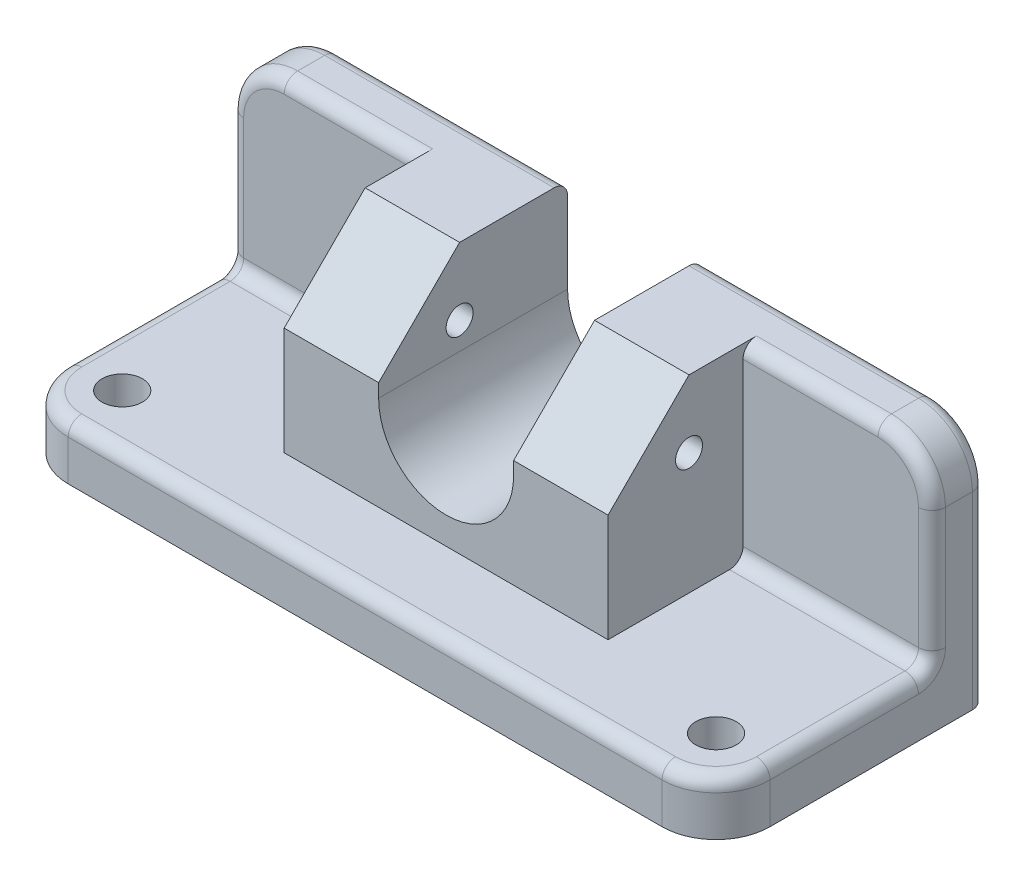
from build123d import *

# Parameters (mm, degrees)
SKETCH1_W                  = 130
SKETCH1_H                  = 100
BOSS_EXTRUDE1_DEPTH        = 20
SKETCH2_W                  = 130
SKETCH2_H                  = 20
BOSS_EXTRUDE2_DEPTH        = 70
FILLET1_R                  = 20
SKETCH3_W                  = 60
SKETCH3_H                  = 70
BOSS_EXTRUDE3_DEPTH        = 50
CUT_EXTRUDE1_DEPTH         = 132.244047484
CHAMFER1_SIZE              = 30
F_10_0_10_DIAMETER_HOLE1_D = 10
F_15_0_15_DIAMETER_HOLE1_D = 15
FILLET2_R                  = 5


with BuildPart() as part:
    # Sketch1 → Boss-Extrude1 (new body)
    with BuildSketch(Plane(origin=(0, 0, 0), x_dir=(1, 0, 0), z_dir=(0, 1, 0))):
        Rectangle(SKETCH1_W, SKETCH1_H)
    extrude(amount=BOSS_EXTRUDE1_DEPTH)

    # Sketch2 → Boss-Extrude2 (add)
    with BuildSketch(Plane(origin=(0, 20, 0), x_dir=(1, 0, 0), z_dir=(0, 1, 0))):
        with Locations((0, 40)):
            Rectangle(SKETCH2_W, SKETCH2_H)
    extrude(amount=BOSS_EXTRUDE2_DEPTH)

    # Fillet1
    fillet1_edges = [part.edges().sort_by_distance(p)[0] for p in [
        (-65, 10, 50),
        (-65, 90, -40),
    ]]
    fillet(fillet1_edges, radius=FILLET1_R)

    # Sketch3 → Boss-Extrude3 (add)
    with BuildSketch(Plane.XY.offset(-30)):
        with Locations((35, 55)):
            Rectangle(SKETCH3_W, SKETCH3_H)
    extrude(amount=BOSS_EXTRUDE3_DEPTH)

    # Sketch4 → Cut-Extrude1 (cut, through all)
    with BuildSketch(Plane.XY.offset(20)):
        with BuildLine():
            Line((40, 90), (40, 55))
            ThreePointArc((40, 55), (47.32233047, 37.32233047), (65, 30))
            Line((65, 30), (65, 90))
            Line((65, 90), (40, 90))
        make_face()
    extrude(amount=-CUT_EXTRUDE1_DEPTH, mode=Mode.SUBTRACT)

    # Chamfer1
    chamfer1_edges = [part.edges().sort_by_distance(p)[0] for p in [
        (22.5, 90, 20),
    ]]
    chamfer(chamfer1_edges, length=CHAMFER1_SIZE)

    # Ø10.0 (10) Diameter Hole1 (through all)
    with Locations(Plane.ZY.offset(-5)):
        with Locations((-10, 65)):
            Hole(F_10_0_10_DIAMETER_HOLE1_D / 2)

    # Ø15.0 (15) Diameter Hole1 (through all)
    with Locations(Plane(origin=(0, 20, 0), x_dir=(1, 0, 0), z_dir=(0, 1, 0))):
        with Locations((-45, -30)):
            Hole(F_15_0_15_DIAMETER_HOLE1_D / 2)

    # Fillet2
    fillet2_edges = [part.edges().sort_by_distance(p)[0] for p in [
        (-65, 20, 0),
        (10, 20, 50),
        (-65, 35, -50),
        (-2.5, 90, -50),
        (-20, 90, -30),
        (-65, 45, -30),
        (-59.142135624, 20, 44.142135624),
        (-59.142135624, 84.142135624, -50),
        (-59.142135624, 84.142135624, -30),
        (-30, 20, -30),
    ]]
    fillet(fillet2_edges, radius=FILLET2_R)

    # 鏡射1: part across plane


with BuildPart() as part_1:
    add(part.part)
    add(part.part.mirror(Plane(origin=(65, 20, 50), x_dir=(0, 0, 1), z_dir=(-1, 0, 0))))


solid = part_1.part
